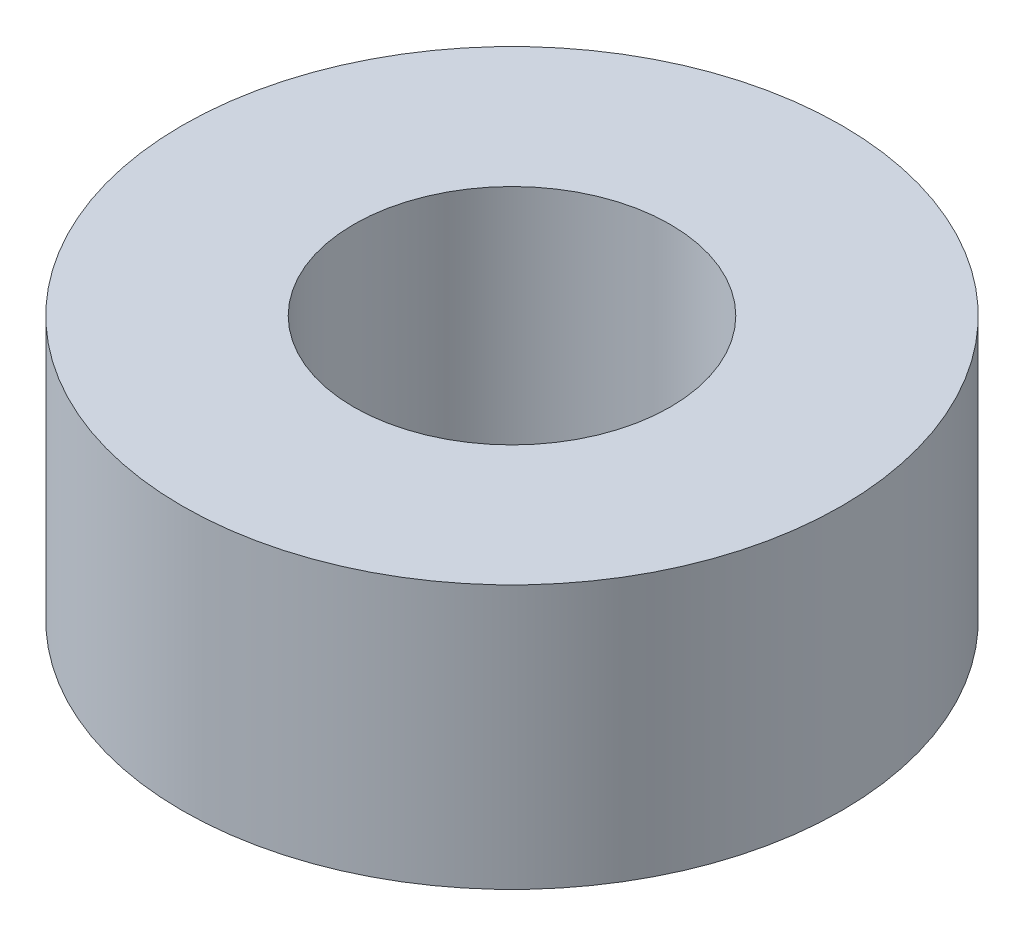
from build123d import *

# Parameters (mm, degrees)
SKETCH1_R           = 6.35
BOSS_EXTRUDE1_DEPTH = 5.08
SKETCH2_R           = 3.048
CUT_EXTRUDE1_DEPTH  = 5.08


with BuildPart() as part:
    # Sketch1 → Boss-Extrude1 (new body)
    with BuildSketch(Plane(origin=(0, 0, 0), x_dir=(1, 0, 0), z_dir=(0, 1, 0))):
        with Locations(Location((0, 0, 0), (0, 0, 270))):
            Circle(SKETCH1_R)
    extrude(amount=BOSS_EXTRUDE1_DEPTH)

    # Sketch2 → Cut-Extrude1 (cut)
    with BuildSketch(Plane(origin=(0, 5.08, 0), x_dir=(1, 0, 0), z_dir=(0, 1, 0))):
        with Locations(Location((0, 0, 0), (0, 0, 270))):
            Circle(SKETCH2_R)
    extrude(amount=-CUT_EXTRUDE1_DEPTH, mode=Mode.SUBTRACT)


solid = part.part
